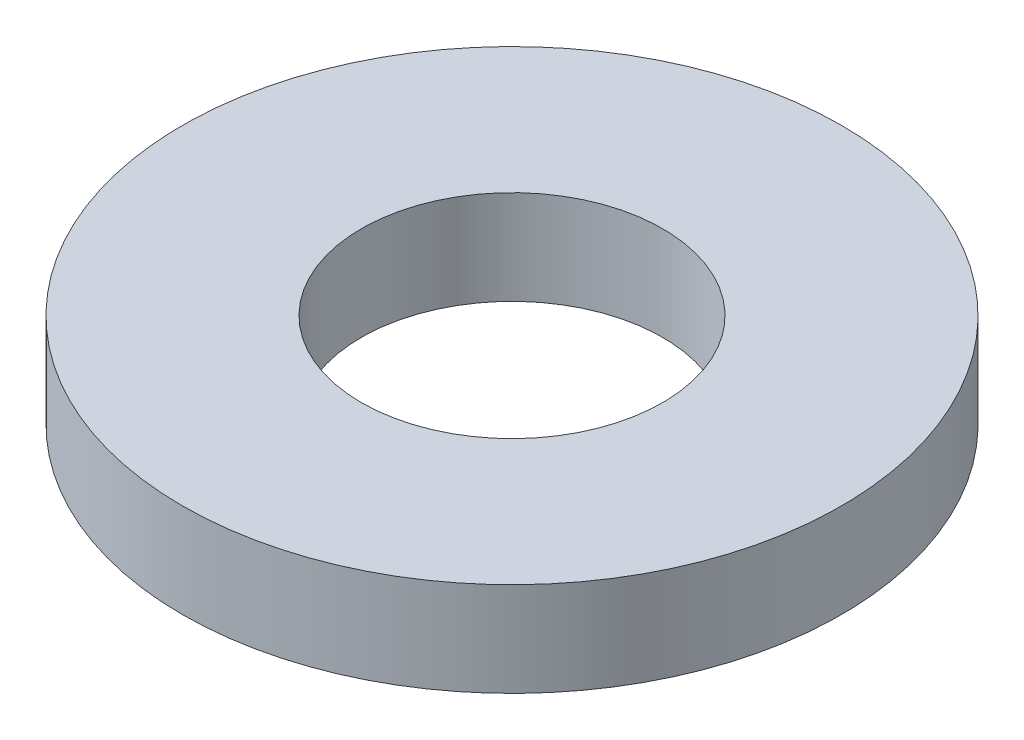
from build123d import *

# Parameters (mm, degrees)
SKETCH1_R           = 17.5
SKETCH1_R_2         = 8
BOSS_EXTRUDE1_DEPTH = 5


with BuildPart() as part:
    # Sketch1 → Boss-Extrude1 (new body)
    with BuildSketch(Plane(origin=(0, 0, 0), x_dir=(1, 0, 0), z_dir=(0, 1, 0))):
        with Locations(Location((0, 0, 0), (0, 0, 270))):
            Circle(SKETCH1_R)
        with Locations(Location((0, 0, 0), (0, 0, 270))):
            Circle(SKETCH1_R_2, mode=Mode.SUBTRACT)
    extrude(amount=BOSS_EXTRUDE1_DEPTH)


solid = part.part
